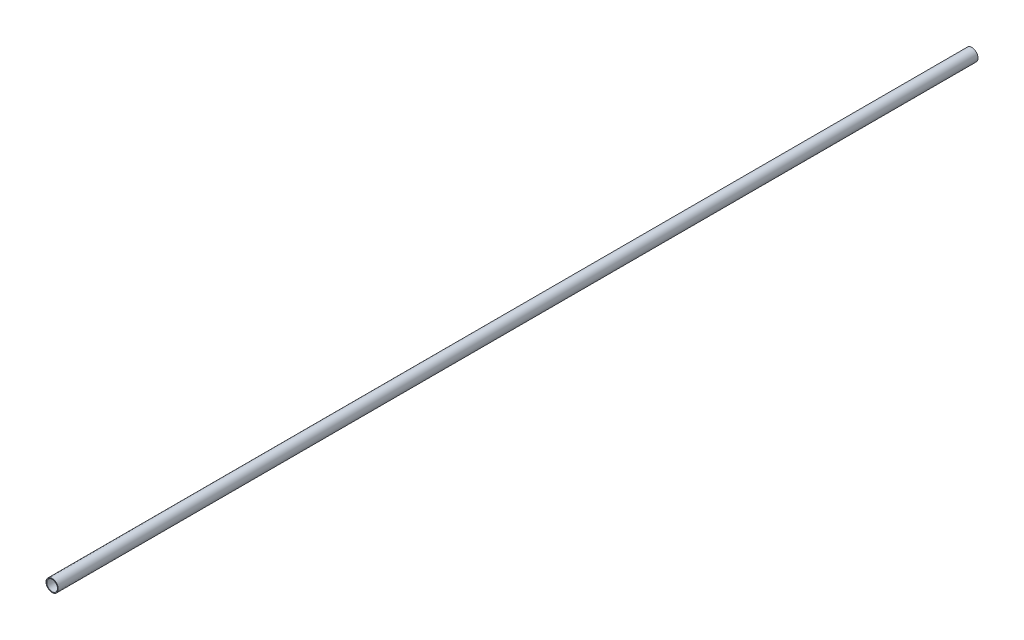
from build123d import *

# Parameters (mm, degrees)
SKETCH_1_R      = 8
SKETCH_1_R_2    = 7
EXTRUDE_1_DEPTH = 600


with BuildPart() as part:
    # Эскиз1 → Бобышка-Вытянуть1 (new, symmetric)
    with BuildSketch(Plane.XY):
        Circle(SKETCH_1_R)
        Circle(SKETCH_1_R_2, mode=Mode.SUBTRACT)
    extrude(amount=EXTRUDE_1_DEPTH, both=True)


solid = part.part
